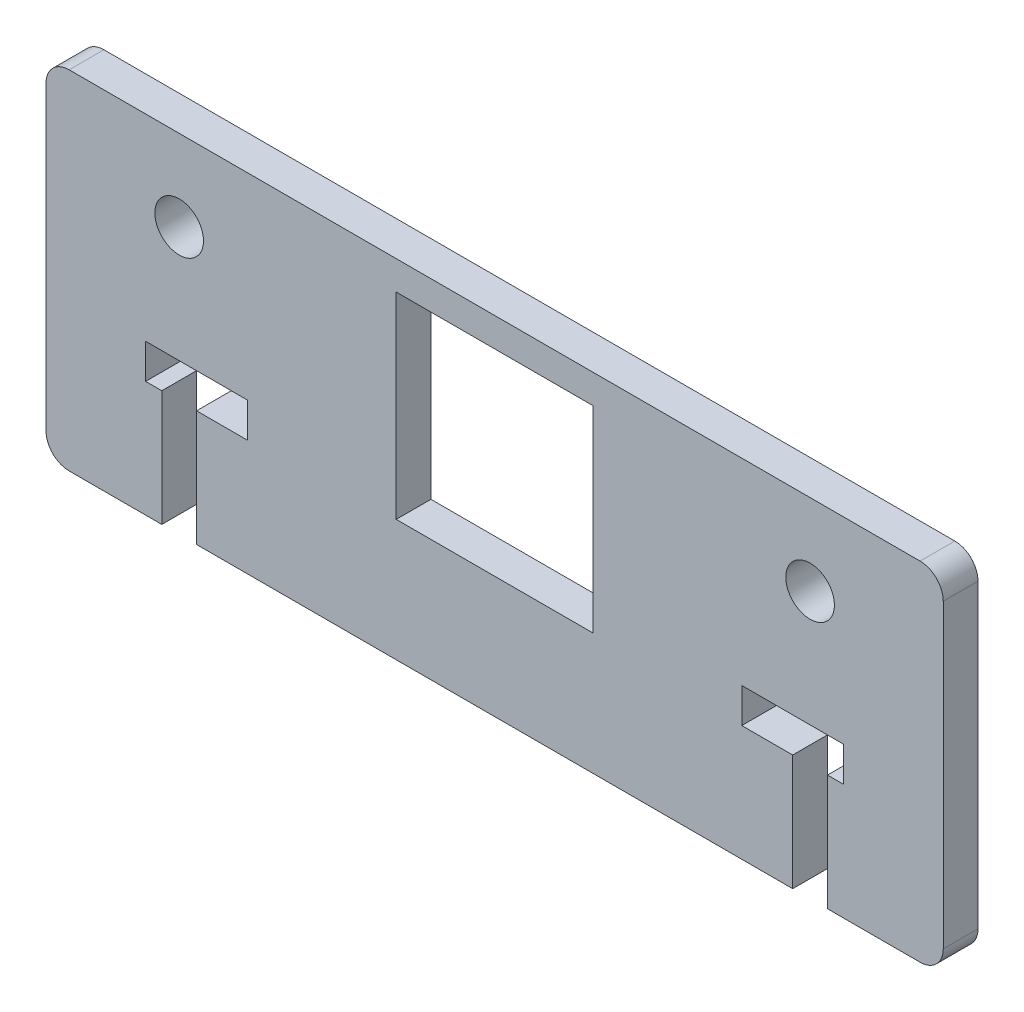
from build123d import *

# Parameters (mm, degrees)
SKETCH_1_R      = 1.05
SKETCH_1_W      = 8.5
SKETCH_1_H      = 8.5
EXTRUDE_1_DEPTH = 1.5
FILLET_1_R      = 1


with BuildPart() as part:
    # 草图1 → 凸台-拉伸1 (new body)
    with BuildSketch(Plane.XY):
        Polygon((1.45, 41.958612035), (27.19, 41.958612035), (27.19, 46.958612035), (24.99, 46.958612035), (24.99, 48.458612035), (29.39, 48.458612035), (29.39, 46.958612035), (28.69, 46.958612035), (28.69, 41.958612035), (33.69, 41.958612035), (33.69, 56.958612035), (14.32, 56.958612035), (-5.05, 56.958612035), (-5.05, 41.958612035), (-0.05, 41.958612035), (-0.05, 46.958612035), (-0.75, 46.958612035), (-0.75, 48.458612035), (3.65, 48.458612035), (3.65, 46.958612035), (1.45, 46.958612035), align=None)
        with Locations((27.94, 53.458612035)):
            Circle(SKETCH_1_R, mode=Mode.SUBTRACT)
        with Locations(Location((0.7, 53.458612035, 0), (0, 0, 180))):
            Circle(SKETCH_1_R, mode=Mode.SUBTRACT)
        with Locations((14.32, 51.458612035)):
            Rectangle(SKETCH_1_W, SKETCH_1_H, mode=Mode.SUBTRACT)
    extrude(amount=EXTRUDE_1_DEPTH)

    # 圆角1
    fillet_1_edges = [part.edges().sort_by_distance(p)[0] for p in [
        (-5.05, 41.958612035, 0.75),
        (-5.05, 56.958612035, 0.75),
        (33.69, 56.958612035, 0.75),
        (33.69, 41.958612035, 0.75),
    ]]
    fillet(fillet_1_edges, radius=FILLET_1_R)


solid = part.part
